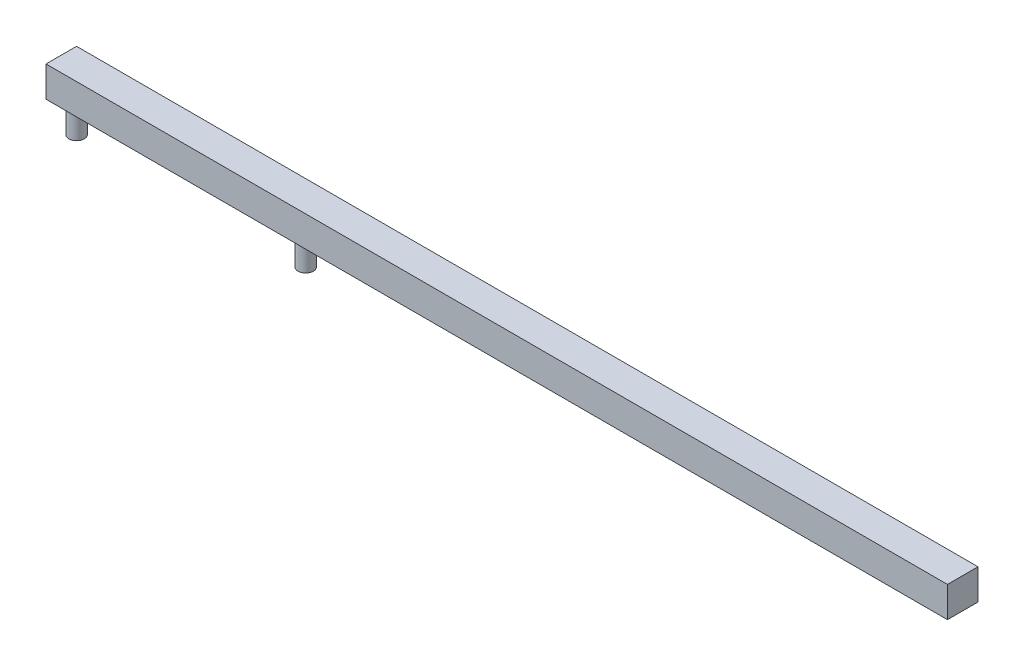
from build123d import *

# Parameters (mm, degrees)
ESQUISSE1_W        = 295
ESQUISSE1_H        = 10
BOSS_EXTRU_1_DEPTH = 10
ESQUISSE2_R        = 2.5
BOSS_EXTRU_2_DEPTH = 10


with BuildPart() as part:
    # Esquisse1 → Boss.-Extru.1 (new body)
    with BuildSketch(Plane(origin=(0, 0, 0), x_dir=(1, 0, 0), z_dir=(0, 1, 0))):
        with Locations((-147.5, -5)):
            Rectangle(ESQUISSE1_W, ESQUISSE1_H)
    extrude(amount=BOSS_EXTRU_1_DEPTH)

    # Esquisse2 → Boss.-Extru.2 (add)
    with BuildSketch(Plane(origin=(0, 0, 0), x_dir=(-1, 0, 0), z_dir=(0, -1, 0))):
        with Locations(Location((290, -5, 0), (0, 0, 90))):
            Circle(ESQUISSE2_R)
        with Locations(Location((215, -5, 0), (0, 0, 90))):
            Circle(ESQUISSE2_R)
    extrude(amount=BOSS_EXTRU_2_DEPTH)


solid = part.part
